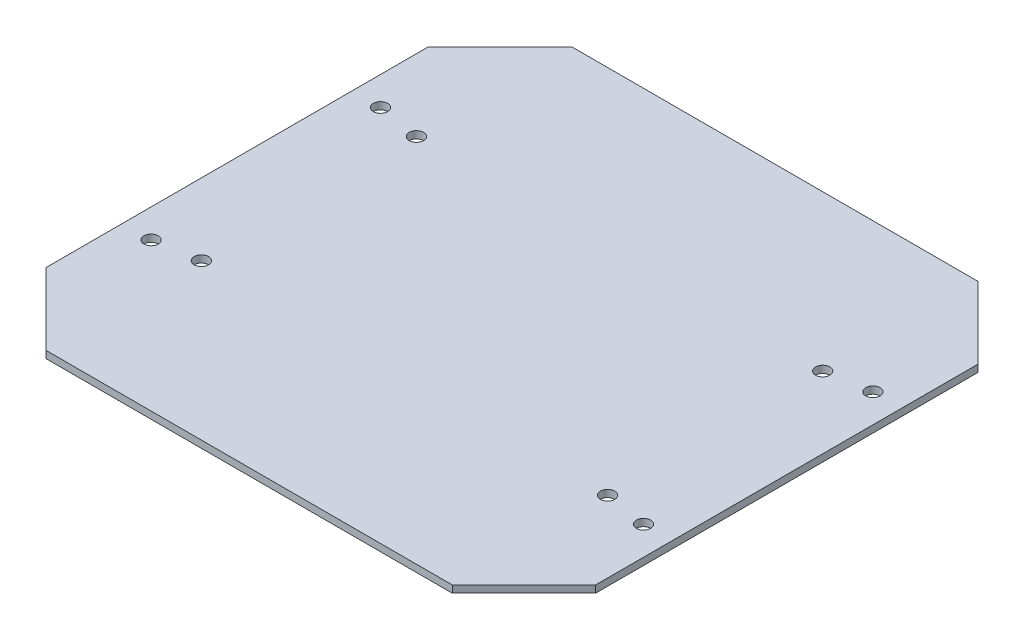
from build123d import *

# Parameters (mm, degrees)
SKETCH1_W           = 115
SKETCH1_H           = 110
BOSS_EXTRUDE1_DEPTH = 1.5
CHAMFER1_SIZE       = 15
SKETCH3_R           = 1.5
CUT_EXTRUDE1_DEPTH  = 1.5
SKETCH4_R           = 1.5
CUT_EXTRUDE2_DEPTH  = 1.5


with BuildPart() as part:
    # Sketch1 → Boss-Extrude1 (new body)
    with BuildSketch(Plane(origin=(0, 0, 0), x_dir=(1, 0, 0), z_dir=(0, 1, 0))):
        Rectangle(SKETCH1_W, SKETCH1_H)
    extrude(amount=BOSS_EXTRUDE1_DEPTH)

    # Chamfer1
    chamfer1_edges = [part.edges().sort_by_distance(p)[0] for p in [
        (57.5, 0.75, 55),
        (-57.5, 0.75, 55),
        (-57.5, 0.75, -55),
        (57.5, 0.75, -55),
    ]]
    chamfer(chamfer1_edges, length=CHAMFER1_SIZE)

    # Sketch3 → Cut-Extrude1 (cut)
    with BuildSketch(Plane(origin=(0, 1.5, 0), x_dir=(1, 0, 0), z_dir=(0, 1, 0))):
        with Locations(Location((-51.515, 24, 0), (0, 0, 270))):
            Circle(SKETCH3_R)
        with Locations(Location((51.515, 24, 0), (0, 0, 270))):
            Circle(SKETCH3_R)
        with Locations(Location((51.515, -24, 0), (0, 0, 270))):
            Circle(SKETCH3_R)
        with Locations(Location((-51.515, -24, 0), (0, 0, 270))):
            Circle(SKETCH3_R)
    extrude(amount=-CUT_EXTRUDE1_DEPTH, mode=Mode.SUBTRACT)

    # Sketch4 → Cut-Extrude2 (cut)
    with BuildSketch(Plane(origin=(0, 1.5, 0), x_dir=(1, 0, 0), z_dir=(0, 1, 0))):
        with Locations(Location((-42.5, 22.5, 0), (0, 0, 270))):
            Circle(SKETCH4_R)
        with Locations(Location((-42.5, -22.5, 0), (0, 0, 270))):
            Circle(SKETCH4_R)
        with Locations(Location((42.5, -22.5, 0), (0, 0, 270))):
            Circle(SKETCH4_R)
        with Locations(Location((42.5, 22.5, 0), (0, 0, 270))):
            Circle(SKETCH4_R)
    extrude(amount=-CUT_EXTRUDE2_DEPTH, mode=Mode.SUBTRACT)


solid = part.part
